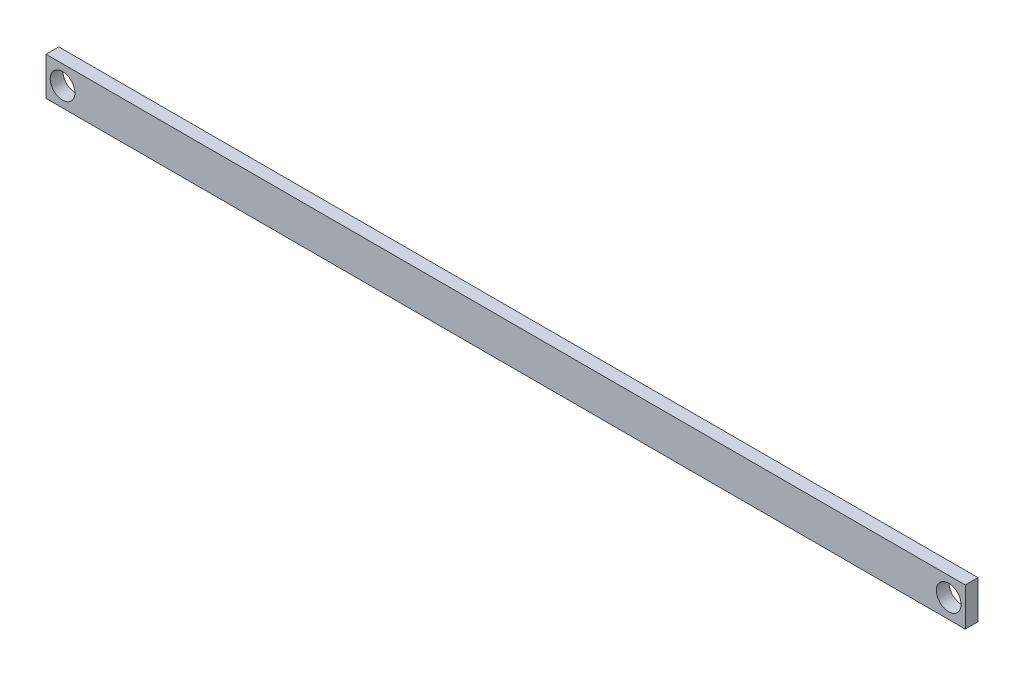
from build123d import *

# Parameters (mm, degrees)
SKETCH2_W           = 360.6
SKETCH2_H           = 15
BOSS_EXTRUDE1_DEPTH = 5
SKETCH3_R           = 4.85
CUT_EXTRUDE1_DEPTH  = 5


with BuildPart() as part:
    # Sketch2 → Boss-Extrude1 (new body)
    with BuildSketch(Plane.XY):
        with Locations((180.3, -7.5)):
            Rectangle(SKETCH2_W, SKETCH2_H)
    extrude(amount=-BOSS_EXTRUDE1_DEPTH)

    # Sketch3 → Cut-Extrude1 (cut)
    with BuildSketch(Plane.XY):
        with Locations((6.5, -7.5)):
            Circle(SKETCH3_R)
        with Locations((354.1, -7.5)):
            Circle(SKETCH3_R)
    extrude(amount=-CUT_EXTRUDE1_DEPTH, mode=Mode.SUBTRACT)


solid = part.part
